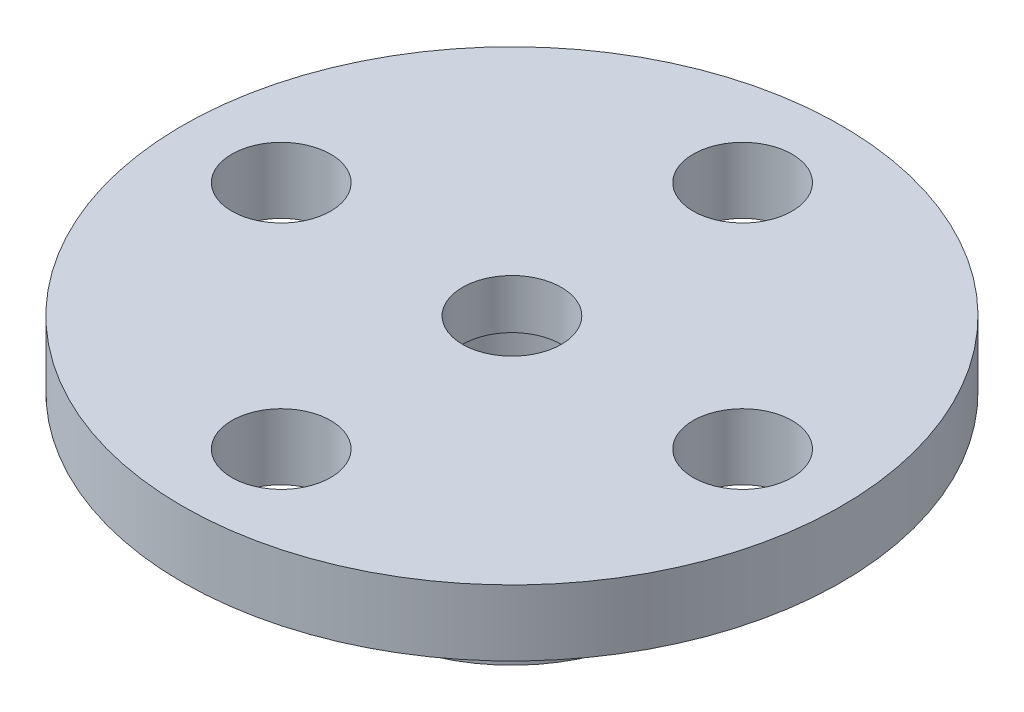
from build123d import *

# Parameters (mm, degrees)
SKETCH_1_R               = 10
SKETCH_1_R_2             = 1.5
EXTRUDE_1_DEPTH          = 2
SKETCH_2_R               = 4.5
EXTRUDE_2_DEPTH          = 4
CUT_EXTRUDE_1_DEPTH      = 15.696938457
CUT_EXTRUDE_1_DEPTH_BACK = 15.696938457
SKETCH_3_R               = 1.5
CUT_EXTRUDE_START        = -4
SKETCH_4_R               = 2.45
CUT_EXTRUDE_2_DEPTH      = 4.5


with BuildPart() as part:
    # 草图1 → 凸台-拉伸1 (new body)
    with BuildSketch(Plane(origin=(0, 0, 0), x_dir=(1, 0, 0), z_dir=(0, 1, 0))):
        with Locations(Location((0, 0, 0), (0, 0, 270))):
            Circle(SKETCH_1_R)
        with Locations(Location((0, 7, 0), (0, 0, 270))):
            Circle(SKETCH_1_R_2, mode=Mode.SUBTRACT)
        with Locations(Location((7, 0, 0), (0, 0, 270))):
            Circle(SKETCH_1_R_2, mode=Mode.SUBTRACT)
        with Locations(Location((0, -7, 0), (0, 0, 270))):
            Circle(SKETCH_1_R_2, mode=Mode.SUBTRACT)
        with Locations(Location((-7, 0, 0), (0, 0, 270))):
            Circle(SKETCH_1_R_2, mode=Mode.SUBTRACT)
    extrude(amount=EXTRUDE_1_DEPTH)

    # 草图2 → 凸台-拉伸2 (add)
    with BuildSketch(Plane(origin=(0, 0, 0), x_dir=(1, 0, 0), z_dir=(0, 1, 0))):
        with Locations(Location((0, 0, 0), (0, 0, 270))):
            Circle(SKETCH_2_R)
    extrude(amount=-EXTRUDE_2_DEPTH)

    # 草图3 → 切除-拉伸1 (cut, two sides: drawn at the far end of the back side and taken through both)
    with BuildSketch(Plane(origin=(0, 0, 0), x_dir=(1, 0, 0), z_dir=(0, 1, 0)).offset(-CUT_EXTRUDE_1_DEPTH_BACK)):
        with Locations(Location((0, 0, 0), (0, 0, 270))):
            Circle(SKETCH_3_R)
    extrude(amount=CUT_EXTRUDE_1_DEPTH + CUT_EXTRUDE_1_DEPTH_BACK, mode=Mode.SUBTRACT)

    # 草图4 → 切除-拉伸2 (cut)
    with BuildSketch(Plane(origin=(0, 0, 0), x_dir=(1, 0, 0), z_dir=(0, 1, 0)).offset(CUT_EXTRUDE_START)):
        with Locations(Location((0, 0, 0), (0, 0, 270))):
            Circle(SKETCH_4_R)
    extrude(amount=CUT_EXTRUDE_2_DEPTH, mode=Mode.SUBTRACT)


solid = part.part
